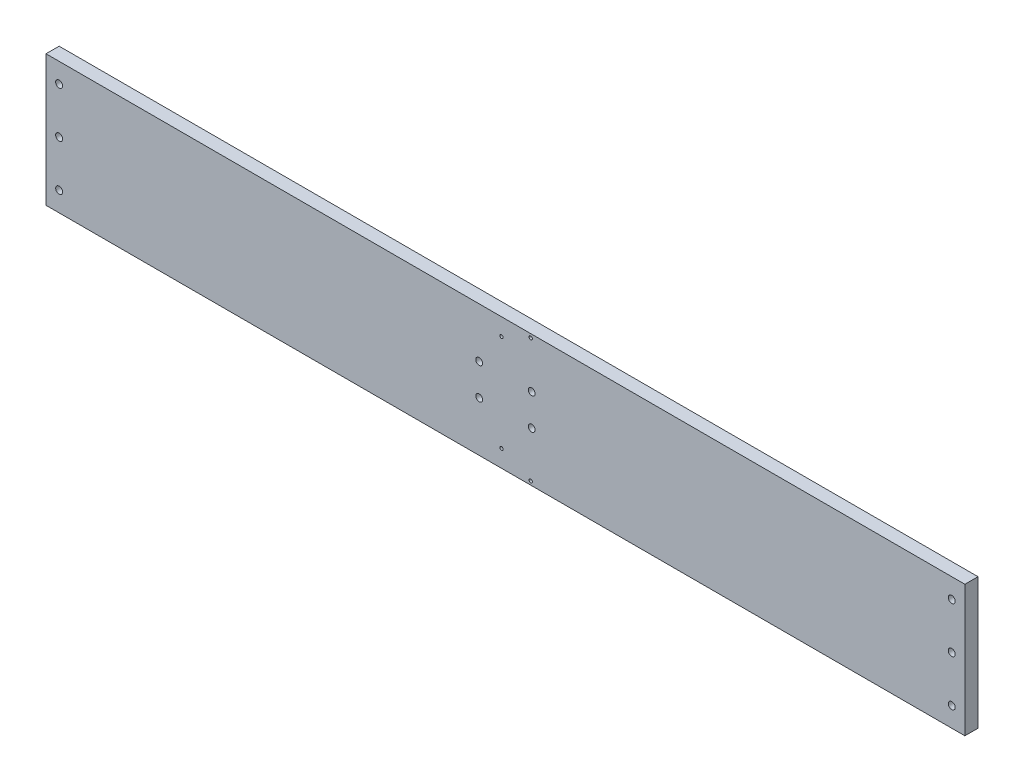
from build123d import *

# Parameters (mm, degrees)
SCHIZZO1_W                     = 700
SCHIZZO1_H                     = 100
ESTRUSIONE_ESTRUSIONE1_DEPTH   = 10
SCHIZZO2_R                     = 2.6
TAGLIO_ESTRUSIONE1_DEPTH       = 708.177488329
M3_TAPPED_HOLE1_D              = 2.5
M3_TAPPED_HOLE1_DEPTH          = 11.5
M3_TAPPED_HOLE1_TIP            = 0.751075774
CBORE_FOR_M5_SHCS1_D           = 5.3
CBORE_FOR_M5_SHCS1_CBORE_D     = 10
CBORE_FOR_M5_SHCS1_CBORE_DEPTH = 5


with BuildPart() as part:
    # Schizzo1 → Estrusione-Estrusione1 (new body)
    with BuildSketch(Plane.XY):
        with Locations((350, 50)):
            Rectangle(SCHIZZO1_W, SCHIZZO1_H)
    extrude(amount=-ESTRUSIONE_ESTRUSIONE1_DEPTH)

    # Schizzo2 → Taglio-Estrusione1 (cut, through all)
    with BuildSketch(Plane.XY):
        with Locations((330, 62)):
            Circle(SCHIZZO2_R)
        with Locations(Location((370, 62, 0), (0, 0, 180))):
            Circle(SCHIZZO2_R)
        with Locations((370, 38)):
            Circle(SCHIZZO2_R)
        with Locations(Location((330, 38, 0), (0, 0, 180))):
            Circle(SCHIZZO2_R)
    extrude(amount=-TAGLIO_ESTRUSIONE1_DEPTH, mode=Mode.SUBTRACT)

    # M3 Tapped Hole1
    with Locations(Plane(origin=(369.247113875, 97.2, 0), x_dir=(1, 0, 0), z_dir=(0, 0, 1))):
        with Locations((0, 0), (-22.2, -10.3), (-22.2, -84.1), (0, -94.4)):
            Hole(M3_TAPPED_HOLE1_D / 2, depth=M3_TAPPED_HOLE1_DEPTH)
            with Locations((0, 0, -(M3_TAPPED_HOLE1_DEPTH + M3_TAPPED_HOLE1_TIP / 2))):  # 118° drill point
                Cone(0, M3_TAPPED_HOLE1_D / 2, M3_TAPPED_HOLE1_TIP, mode=Mode.SUBTRACT)

    # CBORE for M5 SHCS1 (through all)
    with Locations(Plane(origin=(0, 0, -10), x_dir=(1, 0, 0), z_dir=(0, 0, -1))):
        with Locations((10, -85), (10, -50), (10, -15), (690, -85), (690, -50), (690, -15)):
            CounterBoreHole(CBORE_FOR_M5_SHCS1_D / 2, CBORE_FOR_M5_SHCS1_CBORE_D / 2, CBORE_FOR_M5_SHCS1_CBORE_DEPTH)


solid = part.part
